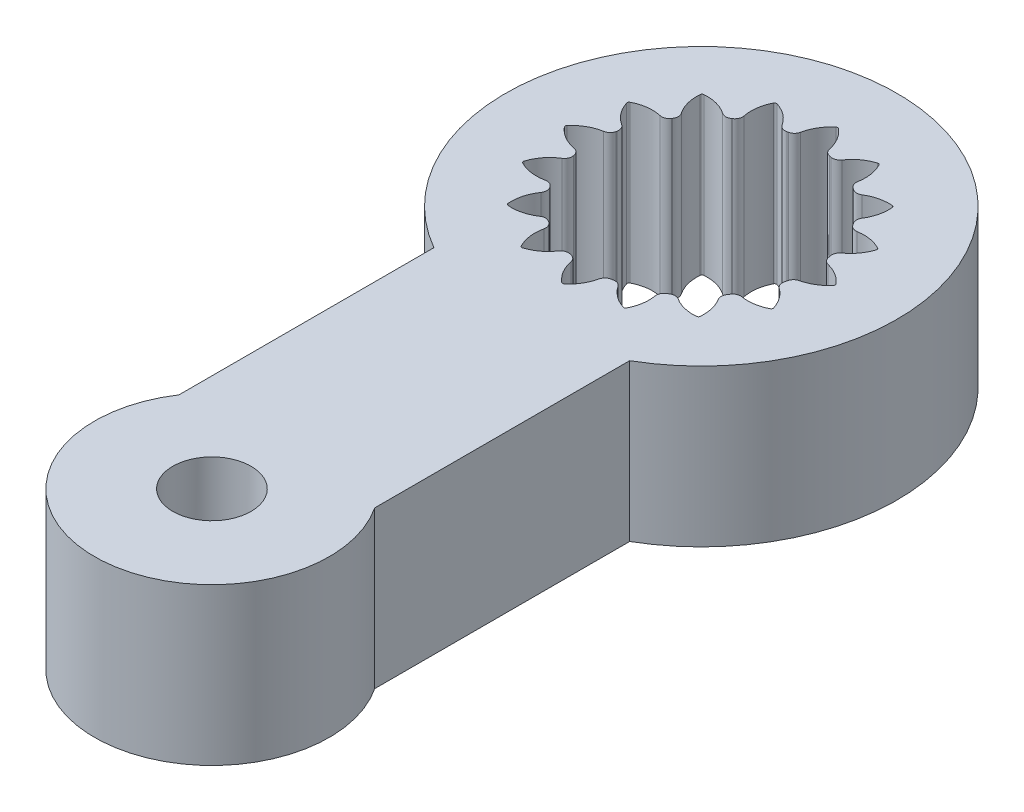
from build123d import *

# Parameters (mm, degrees)
SKETCH1_R           = 10
SKETCH1_R_2         = 5.6
BOSS_EXTRUDE1_DEPTH = 8
CUT_EXTRUDE1_START  = -8
CUT_EXTRUDE1_DEPTH  = 8
BOSS_EXTRUDE2_START = -8
SKETCH3_R           = 2
BOSS_EXTRUDE2_DEPTH = 8
CUT_EXTRUDE2_DEPTH  = 5


with BuildPart() as part:
    # Sketch1 → Boss-Extrude1 (new body)
    with BuildSketch(Plane(origin=(0, 0, 0), x_dir=(1, 0, 0), z_dir=(0, 1, 0))):
        with Locations(Location((0, 0, 0), (0, 0, 270))):
            Circle(SKETCH1_R)
        with Locations(Location((0, 0, 0), (0, 0, 270))):
            Circle(SKETCH1_R_2, mode=Mode.SUBTRACT)
    extrude(amount=BOSS_EXTRUDE1_DEPTH)

    # Sketch2 → Cut-Extrude1 (cut)
    with BuildSketch(Plane(origin=(0, 8, 0), x_dir=(1, 0, 0), z_dir=(0, 1, 0)).offset(CUT_EXTRUDE1_START)):
        with BuildLine():
            ThreePointArc((0.064249913, 6.948346368), (0, 6.971717727), (-0.064249913, 6.948346368))
            ThreePointArc((-0.064249913, 6.948346368), (-0.498286109, 6.437987083), (-0.739423422, 5.812921636))
            ThreePointArc((-0.739423422, 5.812921636), (-0.850059891, 5.608071058), (-1.056027259, 5.499527837))
            ThreePointArc((-1.056027259, 5.499527837), (0, 5.6), (1.056027259, 5.499527837))
            ThreePointArc((1.056027259, 5.499527837), (0.850059891, 5.608071058), (0.739423422, 5.812921636))
            ThreePointArc((0.739423422, 5.812921636), (0.498286109, 6.437987083), (0.064249913, 6.948346368))
        make_face()
        with BuildLine():
            ThreePointArc((-3.07784083, 4.678343278), (-2.13595945, 5.176647296), (-1.116741665, 5.487521121))
            ThreePointArc((-1.116741665, 5.487521121), (-1.350243109, 5.510209511), (-1.530862217, 5.659923992))
            ThreePointArc((-1.530862217, 5.659923992), (-1.996402784, 6.157420979), (-2.601935295, 6.469769583))
            ThreePointArc((-2.601935295, 6.469769583), (-2.670238307, 6.466774526), (-2.720653655, 6.420594828))
            ThreePointArc((-2.720653655, 6.420594828), (-2.927784399, 5.772859186), (-2.905902141, 5.093163831))
            ThreePointArc((-2.905902141, 5.093163831), (-2.928170827, 4.859350312), (-3.07784083, 4.678343278))
        make_face()
        with BuildLine():
            ThreePointArc((1.546699763, 5.647927275), (1.366304802, 5.503873184), (1.136351309, 5.483493932))
            ThreePointArc((1.136351309, 5.483493932), (2.145111804, 5.172861428), (3.077665403, 4.678458685))
            ThreePointArc((3.077665403, 4.678458685), (2.929649667, 4.855512924), (2.904074445, 5.084865862))
            ThreePointArc((2.904074445, 5.084865862), (2.914679464, 5.743680773), (2.710627264, 6.370188757))
            ThreePointArc((2.710627264, 6.370188757), (2.660211916, 6.416368455), (2.591908904, 6.419363512))
            ThreePointArc((2.591908904, 6.419363512), (2.004925243, 6.120871804), (1.546699763, 5.647927275))
        make_face()
        with BuildLine():
            ThreePointArc((-4.626747894, 3.154869874), (-3.942798212, 3.976725067), (-3.115113277, 4.653608199))
            ThreePointArc((-3.115113277, 4.653608199), (-3.341080574, 4.586023742), (-3.565845172, 4.65750628))
            ThreePointArc((-3.565845172, 4.65750628), (-4.193243775, 4.947890892), (-4.882025833, 5.007317379))
            ThreePointArc((-4.882025833, 5.007317379), (-4.943983429, 4.978411876), (-4.972888932, 4.916454281))
            ThreePointArc((-4.972888932, 4.916454281), (-4.914521213, 4.231672555), (-4.62778579, 3.607080208))
            ThreePointArc((-4.62778579, 3.607080208), (-4.55723094, 3.381135785), (-4.626747894, 3.154869874))
        make_face()
        with BuildLine():
            ThreePointArc((3.60147946, 4.613515157), (3.380624437, 4.551916923), (3.162225119, 4.621723953))
            ThreePointArc((3.162225119, 4.621723953), (3.969775698, 3.949795047), (4.637621263, 3.138864289))
            ThreePointArc((4.637621263, 3.138864289), (4.568924656, 3.357086949), (4.631064299, 3.577266461))
            ThreePointArc((4.631064299, 3.577266461), (4.885266795, 4.17532686), (4.934309795, 4.823316006))
            ThreePointArc((4.934309795, 4.823316006), (4.905404292, 4.885273602), (4.843446696, 4.914179105))
            ThreePointArc((4.843446696, 4.914179105), (4.197804444, 4.865705756), (3.60147946, 4.613515157))
        make_face()
        with BuildLine():
            ThreePointArc((-5.477673311, 1.164085519), (-5.155741489, 2.185939087), (-4.645101504, 3.127783883))
            ThreePointArc((-4.645101504, 3.127783883), (-4.829188719, 2.979467261), (-5.064867635, 2.960991018))
            ThreePointArc((-5.064867635, 2.960991018), (-5.762609895, 2.993266281), (-6.428898584, 2.783634848))
            ThreePointArc((-6.428898584, 2.783634848), (-6.475078282, 2.7332195), (-6.478073339, 2.664916489))
            ThreePointArc((-6.478073339, 2.664916489), (-6.160056055, 2.051923175), (-5.652515264, 1.58363038))
            ThreePointArc((-5.652515264, 1.58363038), (-5.499714793, 1.401104329), (-5.477673311, 1.164085519))
        make_face()
        with BuildLine():
            ThreePointArc((5.102964873, 2.86242986), (4.876497297, 2.891701995), (4.702948527, 3.040111043))
            ThreePointArc((4.702948527, 3.040111043), (5.186580684, 2.111724605), (5.488979978, 1.109548918))
            ThreePointArc((5.488979978, 1.109548918), (5.509040687, 1.335802715), (5.649058612, 1.51465515))
            ThreePointArc((5.649058612, 1.51465515), (6.106834087, 1.967933206), (6.396761999, 2.543225468))
            ThreePointArc((6.396761999, 2.543225468), (6.393766942, 2.61152848), (6.347587244, 2.661943828))
            ThreePointArc((6.347587244, 2.661943828), (5.741485734, 2.862816923), (5.102964873, 2.86242986))
        make_face()
        with BuildLine():
            ThreePointArc((-5.510664325, -0.996282441), (-5.599538908, 0.071861119), (-5.483282283, 1.137372148))
            ThreePointArc((-5.483282283, 1.137372148), (-5.597366262, 0.930602816), (-5.808201648, 0.824220718))
            ThreePointArc((-5.808201648, 0.824220718), (-6.468837551, 0.587557408), (-7.007056195, 0.137257497))
            ThreePointArc((-7.007056195, 0.137257497), (-7.030427554, 0.073007584), (-7.007056195, 0.008757671))
            ThreePointArc((-7.007056195, 0.008757671), (-6.479586979, -0.435338259), (-5.8326499, -0.673911904))
            ThreePointArc((-5.8326499, -0.673911904), (-5.621271562, -0.784771791), (-5.510664325, -0.996282441))
        make_face()
        with BuildLine():
            ThreePointArc((5.812810952, 0.664521681), (5.615514351, 0.779198979), (5.513031953, 0.983096477))
            ThreePointArc((5.513031953, 0.983096477), (5.599695706, -0.058378103), (5.49133793, -1.097819539))
            ThreePointArc((5.49133793, -1.097819539), (5.59652681, -0.897662861), (5.793441288, -0.786522929))
            ThreePointArc((5.793441288, -0.786522929), (6.388422373, -0.542837618), (6.875338784, -0.122959741))
            ThreePointArc((6.875338784, -0.122959741), (6.898710143, -0.058709827), (6.875338784, 0.005540086))
            ThreePointArc((6.875338784, 0.005540086), (6.396892952, 0.420193633), (5.812810952, 0.664521681))
        make_face()
        with BuildLine():
            ThreePointArc((-4.723716983, -3.00773966), (-5.209771972, -2.053844201), (-5.505416772, -1.024883487))
            ThreePointArc((-5.505416772, -1.024883487), (-5.532233953, -1.25849938), (-5.685687223, -1.436678055))
            ThreePointArc((-5.685687223, -1.436678055), (-6.204243765, -1.907832783), (-6.52847941, -2.528927711))
            ThreePointArc((-6.52847941, -2.528927711), (-6.525484353, -2.597230723), (-6.479304655, -2.647646071))
            ThreePointArc((-6.479304655, -2.647646071), (-5.827313187, -2.855366074), (-5.14346104, -2.83114388))
            ThreePointArc((-5.14346104, -2.83114388), (-4.906005926, -2.853880543), (-4.723716983, -3.00773966))
        make_face()
        with BuildLine():
            ThreePointArc((-3.231573409, -4.573503395), (-4.040870944, -3.877030051), (-4.703269727, -3.0396141))
            ThreePointArc((-4.703269727, -3.0396141), (-4.639287647, -3.264216822), (-4.711631901, -3.486267262))
            ThreePointArc((-4.711631901, -3.486267262), (-5.005567924, -4.11636587), (-5.066027207, -4.809018249))
            ThreePointArc((-5.066027207, -4.809018249), (-5.037121704, -4.870975845), (-4.975164108, -4.899881348))
            ThreePointArc((-4.975164108, -4.899881348), (-4.301827611, -4.844494009), (-3.685350478, -4.568078128))
            ThreePointArc((-3.685350478, -4.568078128), (-3.457618103, -4.500210794), (-3.231573409, -4.573503395))
        make_face()
        with BuildLine():
            ThreePointArc((5.618520803, -1.63637781), (5.480067966, -1.454143469), (5.464186765, -1.225831555))
            ThreePointArc((5.464186765, -1.225831555), (5.14101235, -2.220358534), (4.638570438, -3.13746144))
            ThreePointArc((4.638570438, -3.13746144), (4.812780485, -2.993714728), (5.037083425, -2.967248735))
            ThreePointArc((5.037083425, -2.967248735), (5.683333022, -2.971442449), (6.297181173, -2.769337092))
            ThreePointArc((6.297181173, -2.769337092), (6.343360871, -2.718921743), (6.346355928, -2.650618732))
            ThreePointArc((6.346355928, -2.650618732), (6.063599568, -2.085255724), (5.618520803, -1.63637781))
        make_face()
        with BuildLine():
            ThreePointArc((-1.251247201, -5.45842289), (-2.260605052, -5.123442671), (-3.188432984, -4.603682777))
            ThreePointArc((-3.188432984, -4.603682777), (-3.044381817, -4.784979292), (-3.024926972, -5.015718698))
            ThreePointArc((-3.024926972, -5.015718698), (-3.05036452, -5.701707725), (-2.842344676, -6.355891))
            ThreePointArc((-2.842344676, -6.355891), (-2.791929328, -6.402070698), (-2.723626316, -6.405065755))
            ThreePointArc((-2.723626316, -6.405065755), (-2.131541606, -6.102796604), (-1.671238282, -5.623159457))
            ThreePointArc((-1.671238282, -5.623159457), (-1.48668328, -5.475931261), (-1.251247201, -5.45842289))
        make_face()
        with BuildLine():
            ThreePointArc((4.553131765, -3.68047341), (4.494207557, -3.457914037), (4.567722636, -3.239739175))
            ThreePointArc((4.567722636, -3.239739175), (3.883669423, -4.034490279), (3.063445285, -4.68778231))
            ThreePointArc((3.063445285, -4.68778231), (3.280286024, -4.622628788), (3.497760134, -4.685635919))
            ThreePointArc((3.497760134, -4.685635919), (4.09857718, -4.943062107), (4.750308422, -4.993019623))
            ThreePointArc((4.750308422, -4.993019623), (4.812266018, -4.964114119), (4.841171521, -4.902156524))
            ThreePointArc((4.841171521, -4.902156524), (4.795474246, -4.268133163), (4.553131765, -3.68047341))
        make_face()
        with BuildLine():
            ThreePointArc((0.925303441, -5.52302576), (-0.130378711, -5.598482061), (-1.181403822, -5.473964286))
            ThreePointArc((-1.181403822, -5.473964286), (-0.980381907, -5.584707692), (-0.873319684, -5.787714078))
            ThreePointArc((-0.873319684, -5.787714078), (-0.632839966, -6.418904201), (-0.195967325, -6.934048611))
            ThreePointArc((-0.195967325, -6.934048611), (-0.131717411, -6.95741997), (-0.067467498, -6.934048611))
            ThreePointArc((-0.067467498, -6.934048611), (0.357915774, -6.438102524), (0.600752826, -5.831518965))
            ThreePointArc((0.600752826, -5.831518965), (0.715816891, -5.627603722), (0.925303441, -5.52302576))
        make_face()
        with BuildLine():
            ThreePointArc((2.787896701, -5.152413925), (2.8176875, -4.922252146), (2.970261988, -4.747372297))
            ThreePointArc((2.970261988, -4.747372297), (2.028927178, -5.219526272), (1.015839733, -5.507092666))
            ThreePointArc((1.015839733, -5.507092666), (1.242257752, -5.531230611), (1.418818304, -5.675015626))
            ThreePointArc((1.418818304, -5.675015626), (1.878837632, -6.153725835), (2.470217884, -6.455471826))
            ThreePointArc((2.470217884, -6.455471826), (2.538520896, -6.452476769), (2.588936244, -6.406297071))
            ThreePointArc((2.588936244, -6.406297071), (2.790550207, -5.795561613), (2.787896701, -5.152413925))
        make_face()
    extrude(amount=CUT_EXTRUDE1_DEPTH, mode=Mode.SUBTRACT)

    # Sketch3 → Boss-Extrude2 (add)
    with BuildSketch(Plane(origin=(0, 8, 0), x_dir=(1, 0, 0), z_dir=(0, 1, 0)).offset(BOSS_EXTRUDE2_START)):
        with BuildLine():
            Line((-5, -8.660254038), (-5, -21.68337521))
            ThreePointArc((-5, -21.68337521), (0, -31), (5, -21.68337521))
            Line((5, -21.68337521), (5, -8.660254038))
            ThreePointArc((5, -8.660254038), (0, -10), (-5, -8.660254038))
        make_face()
        with Locations(Location((0, -25, 0), (0, 0, 270))):
            Circle(SKETCH3_R, mode=Mode.SUBTRACT)
    extrude(amount=BOSS_EXTRUDE2_DEPTH)

    # Sketch4 → Cut-Extrude2 (cut)
    with BuildSketch(Plane.XZ):
        Polygon((1.5011107, 27.6), (-1.5011107, 27.6), (-3.0022214, 25), (-1.5011107, 22.4), (1.5011107, 22.4), (3.0022214, 25), align=None)
    extrude(amount=-CUT_EXTRUDE2_DEPTH, mode=Mode.SUBTRACT)


solid = part.part
